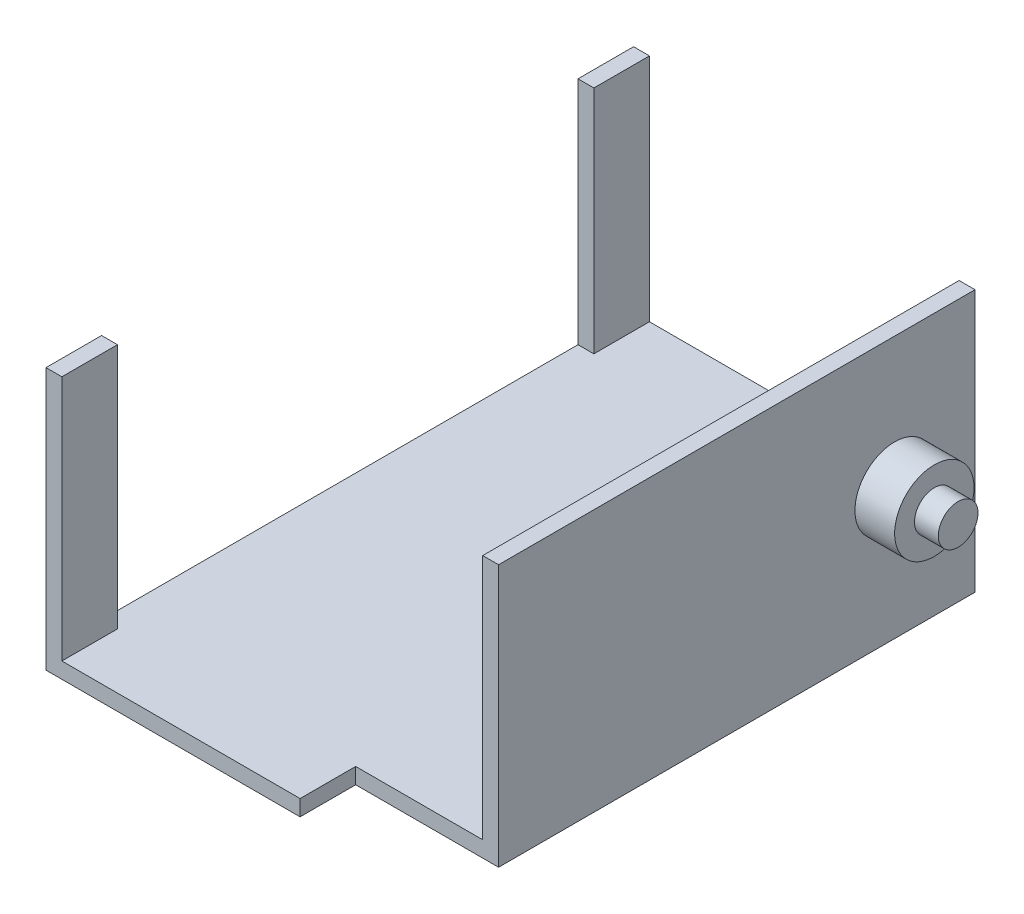
from build123d import *

# Parameters (mm, degrees)
BOSS_EXTRU_1_DEPTH = 2
ESQUISSE4_W        = 2
ESQUISSE4_H        = 33
BOSS_EXTRU_2_DEPTH = 7
ESQUISSE6_W        = 60
ESQUISSE6_H        = 33
BOSS_EXTRU_3_DEPTH = 2
ESQUISSE7_W        = 2
ESQUISSE7_H        = 31
BOSS_EXTRU_4_DEPTH = 7
ESQUISSE8_R        = 5
BOSS_EXTRU_5_DEPTH = 5
ESQUISSE9_R        = 2.5
BOSS_EXTRU_6_DEPTH = 3


with BuildPart() as part:
    # Esquisse1 → Boss.-Extru.1 (new body)
    with BuildSketch(Plane(origin=(0, 0, 0), x_dir=(1, 0, 0), z_dir=(0, 1, 0))):
        Polygon((8.388206388, 24.250614251), (26.388206388, 24.250614251), (26.388206388, -35.749385749), (8.388206388, -35.749385749), (8.388206388, -42.749385749), (-23.611793612, -42.749385749), (-23.611793612, -35.749385749), (-23.611793612, 24.250614251), (-23.611793612, 31.250614251), (8.388206388, 31.250614251), align=None)
    extrude(amount=BOSS_EXTRU_1_DEPTH)

    # Esquisse4 → Boss.-Extru.2 (add)
    with BuildSketch(Plane.XY.offset(42.749385749)):
        with Locations((-22.611793612, 16.5)):
            Rectangle(ESQUISSE4_W, ESQUISSE4_H)
    extrude(amount=-BOSS_EXTRU_2_DEPTH)

    # Esquisse6 → Boss.-Extru.3 (add)
    with BuildSketch(Plane(origin=(26.388206388, 0, 0), x_dir=(0, 0, -1), z_dir=(1, 0, 0))):
        with Locations((-5.749385749, 16.5)):
            Rectangle(ESQUISSE6_W, ESQUISSE6_H)
    extrude(amount=-BOSS_EXTRU_3_DEPTH)

    # Esquisse7 → Boss.-Extru.4 (add)
    with BuildSketch(Plane(origin=(0, 0, -31.250614251), x_dir=(-1, 0, 0), z_dir=(0, 0, -1))):
        with Locations((22.611793612, 15.5)):
            Rectangle(ESQUISSE7_W, ESQUISSE7_H)
    extrude(amount=-BOSS_EXTRU_4_DEPTH)

    # Esquisse8 → Boss.-Extru.5 (add)
    with BuildSketch(Plane(origin=(26.388206388, 0, 0), x_dir=(0, 0, -1), z_dir=(1, 0, 0))):
        with Locations((14.127664827, 16.462750596)):
            Circle(ESQUISSE8_R)
    extrude(amount=BOSS_EXTRU_5_DEPTH)

    # Esquisse9 → Boss.-Extru.6 (add)
    with BuildSketch(Plane(origin=(31.388206388, 0, 0), x_dir=(0, 0, -1), z_dir=(1, 0, 0))):
        with Locations((14.127664827, 16.462750596)):
            Circle(ESQUISSE9_R)
    extrude(amount=BOSS_EXTRU_6_DEPTH)


solid = part.part
